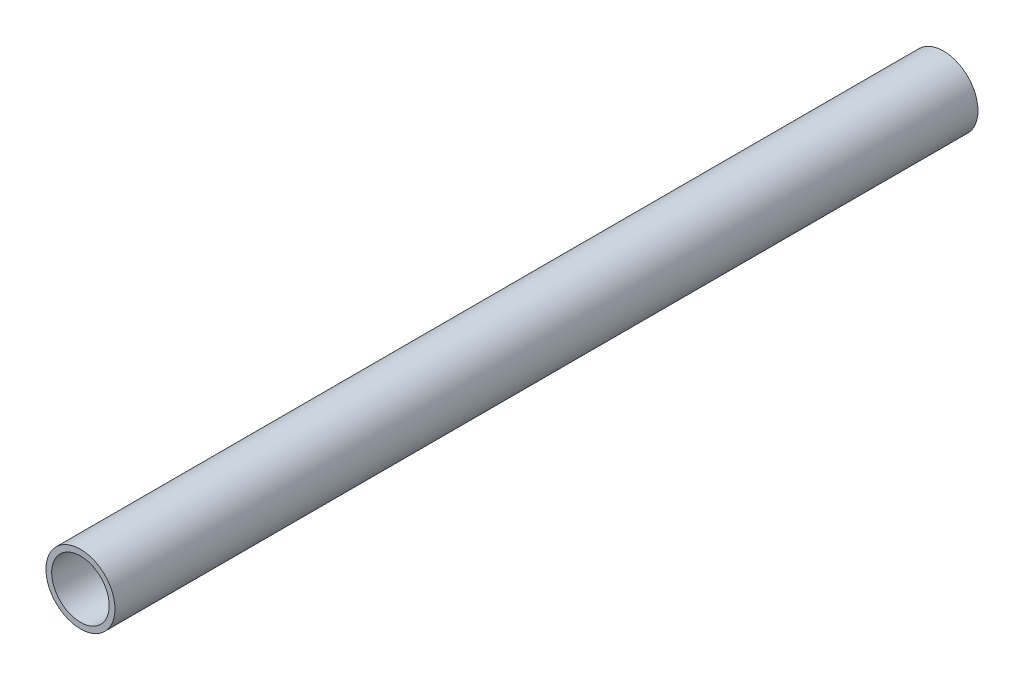
from build123d import *

# Parameters (mm, degrees)
SKETCH1_R           = 6
SKETCH1_R_2         = 5
BOSS_EXTRUDE1_DEPTH = 150


with BuildPart() as part:
    # Sketch1 → Boss-Extrude1 (new body)
    with BuildSketch(Plane.XY):
        Circle(SKETCH1_R)
        Circle(SKETCH1_R_2, mode=Mode.SUBTRACT)
    extrude(amount=BOSS_EXTRUDE1_DEPTH)


solid = part.part
